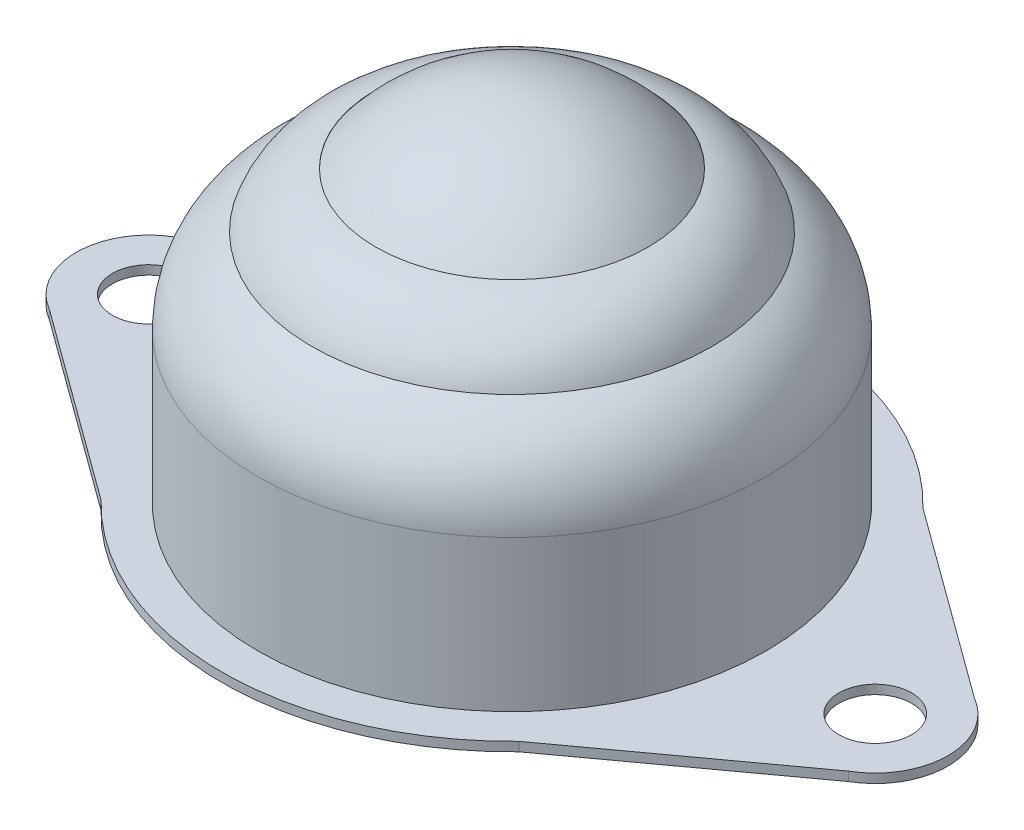
from build123d import *

# Parameters (mm, degrees)
CROQUIS2_R              = 2
SALIENTE_EXTRUIR1_DEPTH = 0.5


with BuildPart() as part:
    # Croquis1 → Revolución1 (revolve)
    with BuildSketch(Plane.XY, mode=Mode.PRIVATE) as revoluci_n1_sk:
        with BuildLine():
            Line((-14, 0), (-14, 8.306675448))
            ThreePointArc((-14, 8.306675448), (-13.185921926, 11.091782957), (-11, 13))
            ThreePointArc((-11, 13), (-9.655968502, 14.97362992), (-7.5, 16))
            Line((-7.5, 16), (-7.464194242, 15.803231233))
            ThreePointArc((-7.464194242, 15.803231233), (-9.558037747, 14.793881218), (-10.838145134, 12.853702577))
            ThreePointArc((-10.838145134, 12.853702577), (-12.994234558, 11.019977862), (-13.8, 8.306675448))
            Line((-13.8, 8.306675448), (-13.8, 0.2))
            Line((-13.8, 0.2), (0, 0.2))
            Line((0, 0.2), (0, 0))
            Line((0, 0), (-14, 0))
        make_face()
    revolve(revoluci_n1_sk.sketch.rotate(Axis((0, -155.434238591, 0), (0, 1, 0)), 180), axis=Axis((0, -155.434238591, 0), (0, 1, 0)))

    # Croquis2 → Saliente-Extruir1 (add)
    with BuildSketch(Plane.XZ):
        with BuildLine():
            Line((-11.5, -11.124297731), (-22, -3.464101615))
            ThreePointArc((-22, -3.464101615), (-24, 0), (-22, 3.464101615))
            Line((-22, 3.464101615), (-11.5, 11.124297731))
            ThreePointArc((-11.5, 11.124297731), (0, 16), (11.5, 11.124297731))
            Line((11.5, 11.124297731), (22, 3.464101615))
            ThreePointArc((22, 3.464101615), (24, 0), (22, -3.464101615))
            Line((22, -3.464101615), (11.5, -11.124297731))
            ThreePointArc((11.5, -11.124297731), (0, -16), (-11.5, -11.124297731))
        make_face()
        with Locations(Location((-20, 0, 0), (0, 0, 180))):
            Circle(CROQUIS2_R, mode=Mode.SUBTRACT)
        with Locations((20, 0)):
            Circle(CROQUIS2_R, mode=Mode.SUBTRACT)
    extrude(amount=SALIENTE_EXTRUIR1_DEPTH)


with BuildPart() as body_2:
    # Croquis4 → Revolución2 (revolve)
    with BuildSketch(Plane.XY):
        with BuildLine():
            Line((0, 19.5), (0, 0))
            ThreePointArc((0, 0), (-9.75, 9.75), (0, 19.5))
        make_face()
    revolve(axis=Axis((0, 19.5, 0), (0, -1, 0)))


solid = Compound([part.part, body_2.part])
